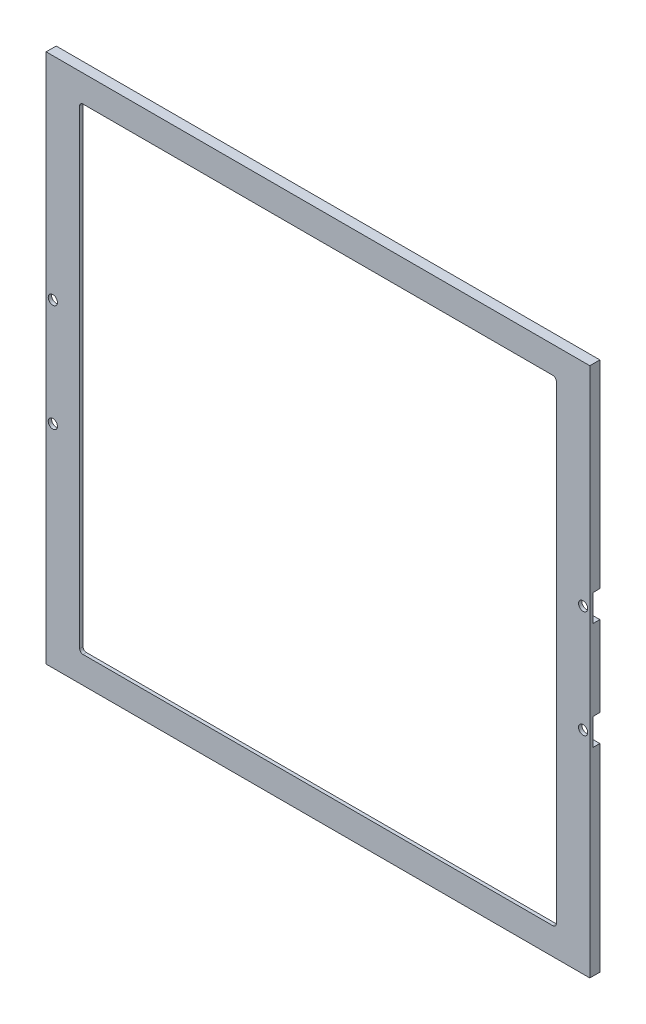
from build123d import *

# Parameters (mm, degrees)
SKETCH1_W                = 502.069989
SKETCH1_H                = 502.069989
SKETCH1_W_2              = 476.669989
SKETCH1_H_2              = 476.669989
EXTRUDE1_DEPTH           = 6.35
SKETCH2_W                = 502.069989
SKETCH2_H                = 502.069989
SKETCH2_W_2              = 451.269989
SKETCH2_H_2              = 451.269989
EXTRUDE2_DEPTH           = 3.175
SKETCH7_W                = 6.35
SKETCH7_H                = 502.069989
EXTRUDE3_DEPTH           = 9.525
F_5_16_CLEARANCE_HOLE1_D = 8.72998
SKETCH8_W                = 19.05
SKETCH8_H                = 25.4
CUT_EXTRUDE1_DEPTH       = 6.35
LPATTERN1_COUNT          = 2
LPATTERN1_PITCH          = 101.6
MIRROR2_COPY_1_SKETCH_W  = 19.05
MIRROR2_COPY_1_SKETCH_H  = 25.4
MIRROR2_COPY_1_DEPTH     = 6.35
EXTRUDE4_DEPTH           = 360.591332428
FILLET1_R                = 3.175


with BuildPart() as part:
    # Sketch1 → Extrude1 (new body)
    with BuildSketch(Plane.XY):
        Rectangle(SKETCH1_W, SKETCH1_H)
        Rectangle(SKETCH1_W_2, SKETCH1_H_2, mode=Mode.SUBTRACT)
    extrude(amount=-EXTRUDE1_DEPTH)

    # Sketch2 → Extrude2 (add)
    with BuildSketch(Plane.XY):
        Rectangle(SKETCH2_W, SKETCH2_H)
        Rectangle(SKETCH2_W_2, SKETCH2_H_2, mode=Mode.SUBTRACT)
    extrude(amount=EXTRUDE2_DEPTH)

    # Sketch7 → Extrude3 (add)
    with BuildSketch(Plane.XY.offset(3.175)):
        with Locations((-254.2099945, 0)):
            Rectangle(SKETCH7_W, SKETCH7_H)
    extrude3 = extrude(amount=-EXTRUDE3_DEPTH)

    # Mirror1: Extrude3 across plane
    add(extrude3.mirror(Plane(origin=(0, 0, 0), x_dir=(0, 0, 1), z_dir=(1, 0, 0))))

    # 5/16 Clearance Hole1 (through all)
    with Locations(Plane.XY.offset(3.175)):
        with Locations((251.0349945, -50.8), (251.0349945, 50.8), (-251.0349945, -50.8), (-251.0349945, 50.8)):
            Hole(F_5_16_CLEARANCE_HOLE1_D / 2)

    # Sketch8 → Cut-Extrude1 (cut)
    with BuildSketch(Plane(origin=(0, 0, -6.35), x_dir=(-1, 0, 0), z_dir=(0, 0, -1))):
        with Locations((247.8599945, 50.8)):
            Rectangle(SKETCH8_W, SKETCH8_H)
    cut_extrude1 = extrude(amount=-CUT_EXTRUDE1_DEPTH, mode=Mode.SUBTRACT)

    # LPattern1: Cut-Extrude1 ×2
    with Locations(*[(0, -i * LPATTERN1_PITCH, 0) for i in range(1, LPATTERN1_COUNT)]):
        add(cut_extrude1, mode=Mode.SUBTRACT)

    # Mirror2: Cut-Extrude1 across plane
    add(cut_extrude1.mirror(Plane(origin=(0, 0, 0), x_dir=(0, 0, 1), z_dir=(1, 0, 0))), mode=Mode.SUBTRACT)

    # Mirror2 copy 1 sketch → Mirror2 copy 1 (cut)
    with BuildSketch(Plane(origin=(0, -101.6, -6.35), x_dir=(1, 0, 0), z_dir=(0, 0, -1))):
        with Locations((247.8599945, -50.8)):
            Rectangle(MIRROR2_COPY_1_SKETCH_W, MIRROR2_COPY_1_SKETCH_H)
    extrude(amount=-MIRROR2_COPY_1_DEPTH, mode=Mode.SUBTRACT)

    # Sketch9 → Extrude4 (cut, through all)
    with BuildSketch(Plane(origin=(0, 0, 0), x_dir=(-1, 0, 0), z_dir=(0, 0, -1))):
        with BuildLine():
            Line((-238.3349945, 238.3349945), (-235.1599945, 238.3349945))
            Line((-235.1599945, 238.3349945), (-235.1599945, 235.1599945))
            ThreePointArc((-235.1599945, 235.1599945), (-240.58005853, 232.91493047), (-238.3349945, 238.3349945))
        make_face()
        with BuildLine():
            Line((235.1599945, 238.3349945), (235.1599945, 235.1599945))
            ThreePointArc((235.1599945, 235.1599945), (240.58005853, 232.91493047), (238.3349945, 238.3349945))
            Line((238.3349945, 238.3349945), (235.1599945, 238.3349945))
        make_face()
        with BuildLine():
            Line((238.3349945, -238.3349945), (235.1599945, -238.3349945))
            Line((235.1599945, -238.3349945), (235.1599945, -235.1599945))
            ThreePointArc((235.1599945, -235.1599945), (240.58005853, -232.91493047), (238.3349945, -238.3349945))
        make_face()
        with BuildLine():
            Line((-235.1599945, -238.3349945), (-235.1599945, -235.1599945))
            ThreePointArc((-235.1599945, -235.1599945), (-240.58005853, -232.91493047), (-238.3349945, -238.3349945))
            Line((-238.3349945, -238.3349945), (-235.1599945, -238.3349945))
        make_face()
    extrude(amount=EXTRUDE4_DEPTH, mode=Mode.SUBTRACT)

    # Fillet1
    fillet1_edges = [part.edges().sort_by_distance(p)[0] for p in [
        (-225.6349945, 225.6349945, 1.5875),
        (-225.6349945, -225.6349945, 1.5875),
        (225.6349945, -225.6349945, 1.5875),
        (225.6349945, 225.6349945, 1.5875),
    ]]
    fillet(fillet1_edges, radius=FILLET1_R)


solid = part.part
